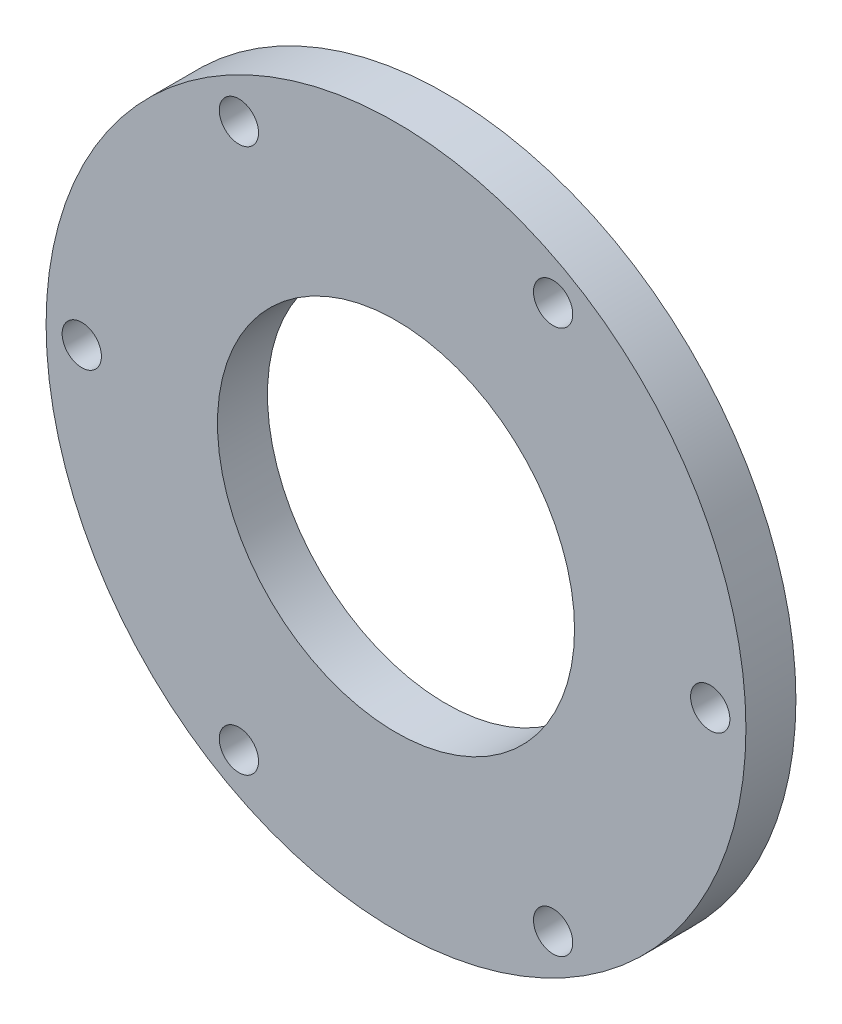
from build123d import *

# Parameters (mm, degrees)
SZKIC1_R                                            = 49
SZKIC1_R_2                                          = 25
DODANIE_WYCI_GNI_CIE1_DEPTH                         = 7
POG_BIENIE_STO_KOWE_POD_M5_DIN965_WKR_T_D           = 5.5
POG_BIENIE_STO_KOWE_POD_M5_DIN965_WKR_T_CSINK_D     = 9.2
POG_BIENIE_STO_KOWE_POD_M5_DIN965_WKR_T_CSINK_ANGLE = 90
SZYK_KO_OWY1_COUNT                                  = 6
SZKIC5_R                                            = 3.3
WYTNIJ_WYCI_GNI_CIE1_DEPTH                          = 6


with BuildPart() as part:
    # Szkic1 → Dodanie-wyciągnięcie1 (new body)
    with BuildSketch(Plane.XY):
        Circle(SZKIC1_R)
        Circle(SZKIC1_R_2, mode=Mode.SUBTRACT)
    extrude(amount=DODANIE_WYCI_GNI_CIE1_DEPTH)

    # Pogłębienie stożkowe pod M5 DIN965 Wkręt z łbem płaskim1 (through all)
    with Locations(Plane(origin=(0, 0, 0), x_dir=(-1, 0, 0), z_dir=(0, 0, -1))):
        with Locations((44, 0)):
            pog_bienie_sto_kowe_pod_m5_din965_wkr_t = CounterSinkHole(POG_BIENIE_STO_KOWE_POD_M5_DIN965_WKR_T_D / 2, POG_BIENIE_STO_KOWE_POD_M5_DIN965_WKR_T_CSINK_D / 2, counter_sink_angle=POG_BIENIE_STO_KOWE_POD_M5_DIN965_WKR_T_CSINK_ANGLE)

    # Szyk kołowy1: Pogłębienie stożkowe pod M5 DIN965 Wkręt z łbem płaskim1 ×6 about axis
    szyk_ko_owy1_axis = Axis((0, 0, 0), (0, 0, 1))
    for i in range(1, SZYK_KO_OWY1_COUNT):
        add(pog_bienie_sto_kowe_pod_m5_din965_wkr_t.rotate(szyk_ko_owy1_axis, i * 360 / SZYK_KO_OWY1_COUNT), mode=Mode.SUBTRACT)

    # Szkic5 → Wytnij-wyciągnięcie1 (cut)
    with BuildSketch(Plane(origin=(0, 0, 0), x_dir=(-1, 0, 0), z_dir=(0, 0, -1))):
        with Locations((23.6, 23.6)):
            Circle(SZKIC5_R)
        with Locations((23.6, -23.6)):
            Circle(SZKIC5_R)
        with Locations((-23.6, 23.6)):
            Circle(SZKIC5_R)
        with Locations((-23.6, -23.6)):
            Circle(SZKIC5_R)
    extrude(amount=-WYTNIJ_WYCI_GNI_CIE1_DEPTH, mode=Mode.SUBTRACT)


solid = part.part
